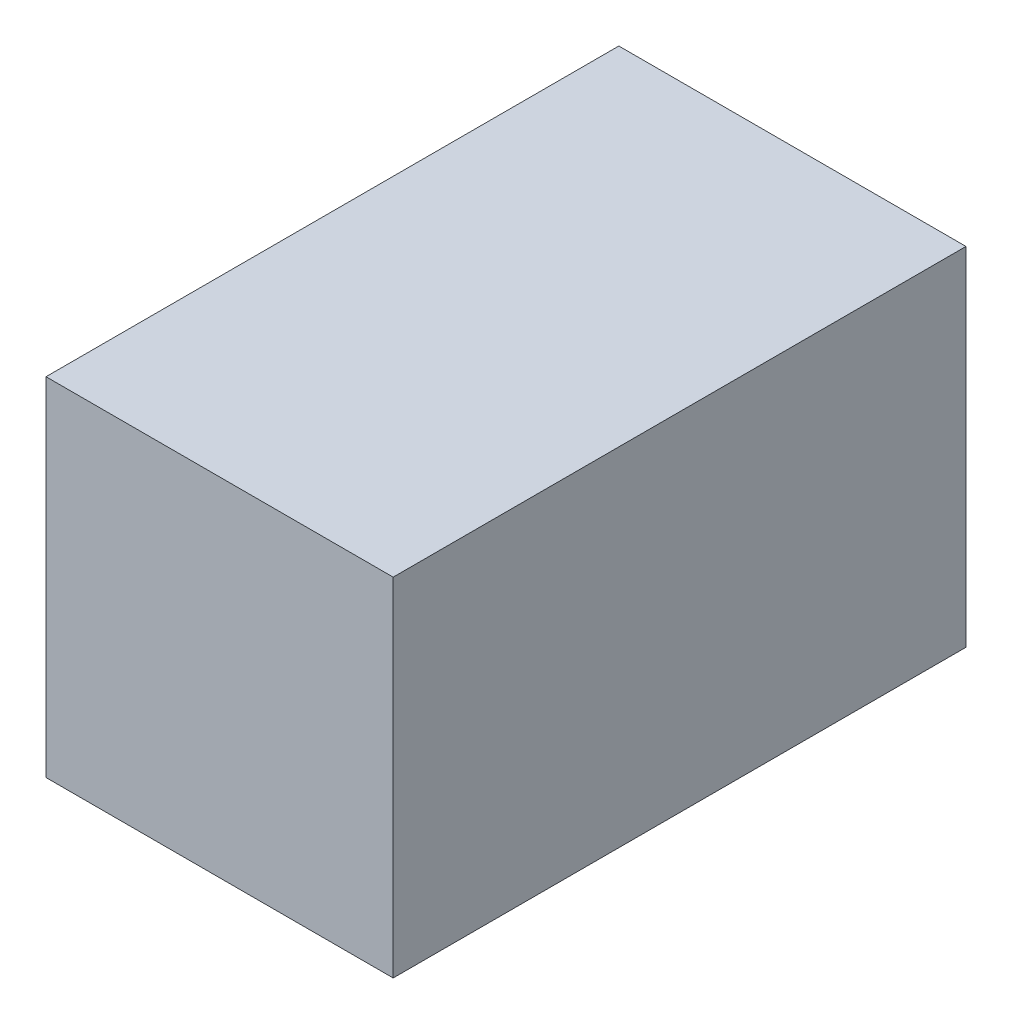
from build123d import *

# Parameters (mm, degrees)
CROQUIS1_W              = 2
CROQUIS1_H              = 3.3
SALIENTE_EXTRUIR1_DEPTH = 2


with BuildPart() as part:
    # Croquis1 → Saliente-Extruir1 (new body)
    with BuildSketch(Plane(origin=(0, 0, 0), x_dir=(1, 0, 0), z_dir=(0, 1, 0))):
        Rectangle(CROQUIS1_W, CROQUIS1_H)
    extrude(amount=SALIENTE_EXTRUIR1_DEPTH)


solid = part.part
